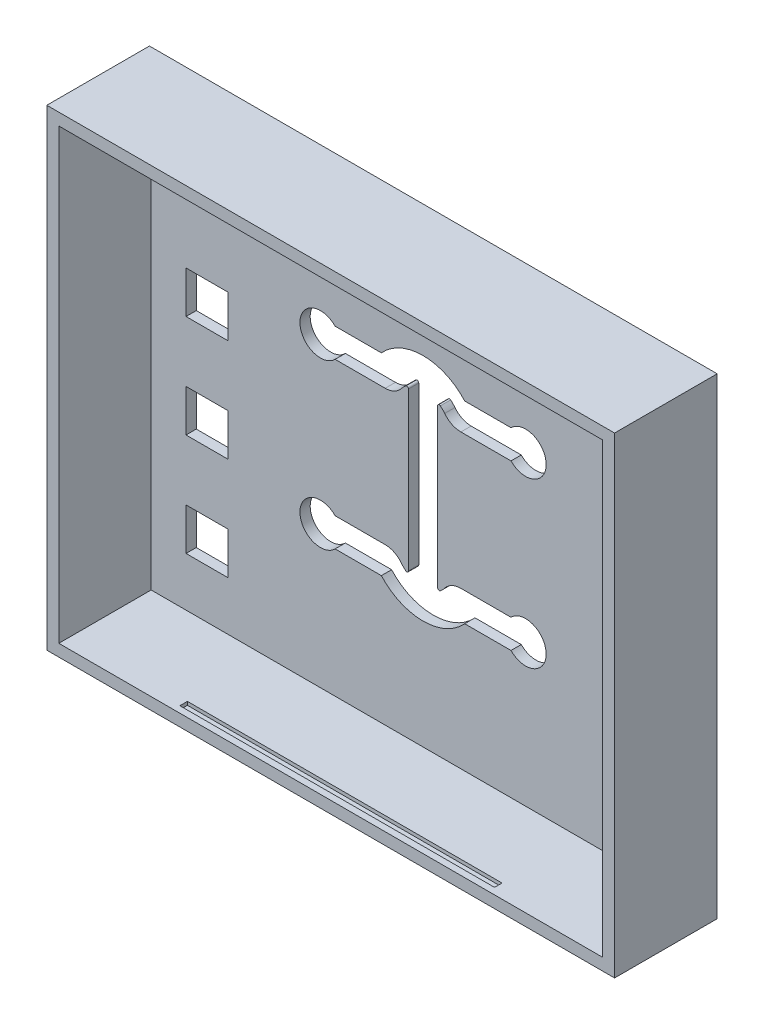
from build123d import *

# Parameters (mm, degrees)
SKETCH_1_W           = 166
SKETCH_1_H           = 138
EXTRUDE_1_DEPTH      = 3
SKETCH_2_W           = 166
SKETCH_2_H           = 138
SKETCH_2_W_2         = 159
SKETCH_2_H_2         = 131
EXTRUDE_2_DEPTH      = 27
SKETCH_3_W           = 92
SKETCH_3_H           = 2.2
CUT_EXTRUDE_1_DEPTH  = 1
SKETCH_4_W           = 92
SKETCH_4_H           = 2.2
CUT_EXTRUDE_2_DEPTH  = 1
SKETCH_11_W          = 12.3
SKETCH_11_H          = 12.3
CUT_EXTRUDE_8_DEPTH  = 10
CUT_EXTRUDE_12_DEPTH = 10
FILLET_1_R           = 6
FILLET_2_R           = 0.5


with BuildPart() as part:
    # 스케치1 → 보스-돌출1 (new body)
    with BuildSketch(Plane.XY):
        Rectangle(SKETCH_1_W, SKETCH_1_H)
    extrude(amount=EXTRUDE_1_DEPTH)

    # 스케치2 → 보스-돌출2 (add)
    with BuildSketch(Plane.XY.offset(3)):
        Rectangle(SKETCH_2_W, SKETCH_2_H)
        Rectangle(SKETCH_2_W_2, SKETCH_2_H_2, mode=Mode.SUBTRACT)
    extrude(amount=EXTRUDE_2_DEPTH)

    # 스케치3 → 컷-돌출1 (cut)
    with BuildSketch(Plane.XZ.offset(-65.5)):
        with Locations((0, 27)):
            Rectangle(SKETCH_3_W, SKETCH_3_H)
    extrude(amount=-CUT_EXTRUDE_1_DEPTH, mode=Mode.SUBTRACT)

    # 스케치4 → 컷-돌출2 (cut)
    with BuildSketch(Plane(origin=(0, -65.5, 0), x_dir=(1, 0, 0), z_dir=(0, 1, 0))):
        with Locations((0, -27)):
            Rectangle(SKETCH_4_W, SKETCH_4_H)
    extrude(amount=-CUT_EXTRUDE_2_DEPTH, mode=Mode.SUBTRACT)

    # 스케치11 → 컷-돌출8 (cut)
    with BuildSketch(Plane(origin=(0, 0, 0), x_dir=(-1, 0, 0), z_dir=(0, 0, -1))):
        with Locations((63.15, 15)):
            Rectangle(SKETCH_11_W, SKETCH_11_H)
        with Locations((63.15, 45)):
            Rectangle(SKETCH_11_W, SKETCH_11_H)
        with Locations((63.15, -15)):
            Rectangle(SKETCH_11_W, SKETCH_11_H)
        with Locations((63.15, -45)):
            Rectangle(SKETCH_11_W, SKETCH_11_H)
    extrude(amount=-CUT_EXTRUDE_8_DEPTH, mode=Mode.SUBTRACT)

    # 스케치15 → 컷-돌출12 (cut)
    with BuildSketch(Plane(origin=(0, 0, 0), x_dir=(-1, 0, 0), z_dir=(0, 0, -1))):
        with BuildLine():
            ThreePointArc((25.715142943, -28.2), (36, -24), (25.715142943, -19.8))
            Line((25.715142943, -19.8), (7.573331842, -19.8))
            ThreePointArc((7.573331842, -19.8), (6.273579039, -22.186370807), (4.25, -24))
            Line((4.25, -24), (4.25, 24))
            ThreePointArc((4.25, 24), (6.273579039, 22.186370807), (7.573331842, 19.8))
            Line((7.573331842, 19.8), (25.715142943, 19.8))
            ThreePointArc((25.715142943, 19.8), (36, 24), (25.715142943, 28.2))
            Line((25.715142943, 28.2), (12.183991333, 28.2))
            ThreePointArc((12.183991333, 28.2), (0, 33.622279144), (-12.183991333, 28.2))
            Line((-12.183991333, 28.2), (-25.715142943, 28.2))
            ThreePointArc((-25.715142943, 28.2), (-36, 24), (-25.715142943, 19.8))
            Line((-25.715142943, 19.8), (-7.573331842, 19.8))
            ThreePointArc((-7.573331842, 19.8), (-6.273579039, 22.186370807), (-4.25, 24))
            Line((-4.25, 24), (-4.25, -24))
            ThreePointArc((-4.25, -24), (-6.273579039, -22.186370807), (-7.573331842, -19.8))
            Line((-7.573331842, -19.8), (-25.715142943, -19.8))
            ThreePointArc((-25.715142943, -19.8), (-36, -24), (-25.715142943, -28.2))
            Line((-25.715142943, -28.2), (-12.183991333, -28.2))
            ThreePointArc((-12.183991333, -28.2), (0, -33.622279144), (12.183991333, -28.2))
            Line((12.183991333, -28.2), (25.715142943, -28.2))
        make_face()
    extrude(amount=-CUT_EXTRUDE_12_DEPTH, mode=Mode.SUBTRACT)

    # 필렛1
    fillet_1_edges = [part.edges().sort_by_distance(p)[0] for p in [
        (7.573331842, -19.8, 1.5),
        (-7.573331842, -19.8, 1.5),
        (7.573331842, 19.8, 1.5),
        (-7.573331842, 19.8, 1.5),
    ]]
    fillet(fillet_1_edges, radius=FILLET_1_R)

    # 필렛2
    fillet_2_edges = [part.edges().sort_by_distance(p)[0] for p in [
        (-4.25, -24, 1.5),
        (4.25, 24, 1.5),
        (4.25, -24, 1.5),
        (-4.25, 24, 1.5),
    ]]
    fillet(fillet_2_edges, radius=FILLET_2_R)


solid = part.part
